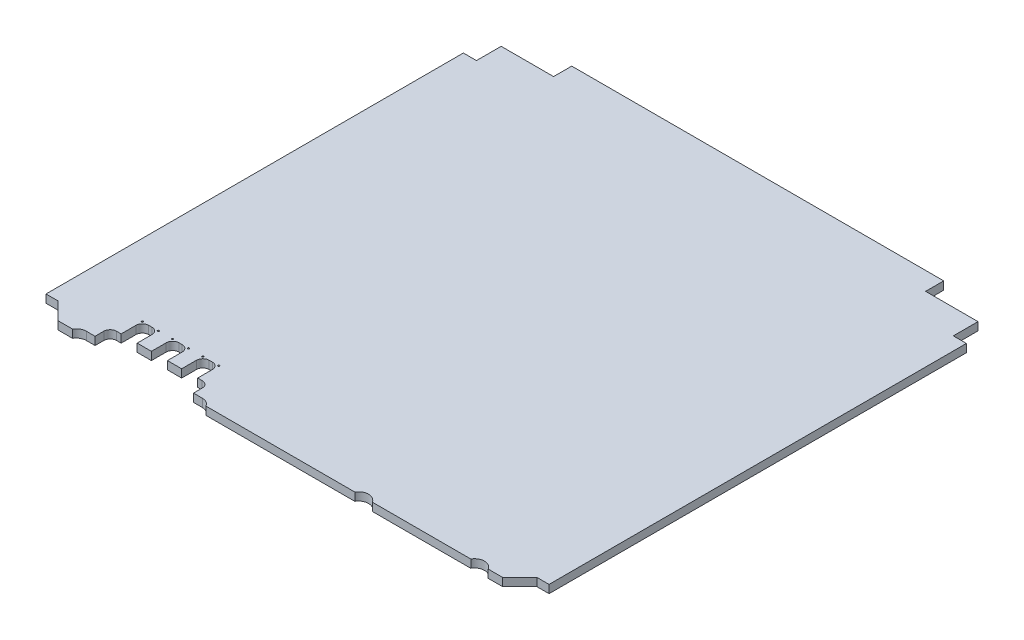
from build123d import *

# Parameters (mm, degrees)
GENERALSHAPE_DEPTH           = 0.8
ADDTOLERANCE_DEPTH           = 71.715203457
ADDTOLERANCE_DEPTH_BACK      = 71.715203457
BACKPLANE_DEPTH              = 71.573791169
BACKPLANE_DEPTH_BACK         = 71.573791169
RF_W                         = 3.18
RF_H                         = 4.2
CUT_EXTRUDE1_DEPTH           = 71.587392642
FILLET1_R                    = 1.27
F_0_32_0_32_DIAMETER_HOLE1_D = 0.32


with BuildPart() as part:
    # Sketch2 → GeneralShape (new, symmetric)
    with BuildSketch(Plane(origin=(0, 0, 0), x_dir=(1, 0, 0), z_dir=(0, 1, 0))):
        Polygon((47.4, 46.4), (37, 46.4), (37, 50), (-37, 50), (-37, 46.4), (-47.4, 46.4), (-47.4, 41.5), (-50, 41.5), (-50, -41.5), (-47.4, -41.5), (-41.5, -47.4), (41.5, -47.4), (47.4, -41.5), (50, -41.5), (50, 41.5), (47.4, 41.5), align=None)
    extrude(amount=GENERALSHAPE_DEPTH, both=True)

    # Sketch3 → AddTolerance (cut, two sides: drawn at the far end of the back side and taken through both)
    with BuildSketch(Plane(origin=(0, 0, 0), x_dir=(1, 0, 0), z_dir=(0, 1, 0)).offset(-ADDTOLERANCE_DEPTH_BACK)):
        Polygon((37, 50), (-37, 50), (-37, 46.4), (-47.4, 46.4), (-47.4, 41.5), (-50, 41.5), (-50, -41.5), (-47.4, -41.5), (-47.5, -41.4), (-49.9, -41.4), (-49.9, 41.4), (-47.3, 41.4), (-47.3, 46.3), (-36.9, 46.3), (-36.9, 49.9), (36.9, 49.9), (36.9, 46.3), (47.3, 46.3), (47.3, 41.4), (49.9, 41.4), (49.9, -41.4), (47.5, -41.4), (47.4, -41.5), (50, -41.5), (50, 41.5), (47.4, 41.5), (47.4, 46.4), (37, 46.4), align=None)
    extrude(amount=ADDTOLERANCE_DEPTH + ADDTOLERANCE_DEPTH_BACK, mode=Mode.SUBTRACT)

    # Sketch4 → Backplane (cut, two sides: drawn at the far end of the back side and taken through both)
    with BuildSketch(Plane(origin=(0, 0, 0), x_dir=(1, 0, 0), z_dir=(0, 1, 0)).offset(-BACKPLANE_DEPTH_BACK)):
        with BuildLine():
            Line((41.5, -47.4), (44.1, -44.8))
            Line((44.1, -44.8), (41.232050808, -44.8))
            ThreePointArc((41.232050808, -44.8), (39.5, -43.8), (37.767949192, -44.8))
            Line((37.767949192, -44.8), (18.232050808, -44.8))
            ThreePointArc((18.232050808, -44.8), (16.5, -43.8), (14.767949192, -44.8))
            Line((14.767949192, -44.8), (-14.767949192, -44.8))
            ThreePointArc((-14.767949192, -44.8), (-16.5, -43.8), (-18.232050808, -44.8))
            Line((-18.232050808, -44.8), (-37.767949192, -44.8))
            ThreePointArc((-37.767949192, -44.8), (-39.5, -43.8), (-41.232050808, -44.8))
            Line((-41.232050808, -44.8), (-44.1, -44.8))
            Line((-44.1, -44.8), (-41.5, -47.4))
            Line((-41.5, -47.4), (41.5, -47.4))
        make_face()
    extrude(amount=BACKPLANE_DEPTH + BACKPLANE_DEPTH_BACK, mode=Mode.SUBTRACT)

    # RF → Cut-Extrude1 (cut, through all)
    with BuildSketch(Plane(origin=(0, 0.8, 0), x_dir=(1, 0, 0), z_dir=(0, 1, 0))):
        with Locations((-22, -38.7)):
            Rectangle(RF_W, RF_H)
        with Locations((-28, -38.7)):
            Rectangle(RF_W, RF_H)
        with Locations((-34, -38.7)):
            Rectangle(RF_W, RF_H)
        with BuildLine():
            Line((-18.232050808, -40.8), (-20.41, -40.8))
            Line((-20.41, -40.8), (-23.59, -40.8))
            Line((-23.59, -40.8), (-26.41, -40.8))
            Line((-26.41, -40.8), (-29.59, -40.8))
            Line((-29.59, -40.8), (-32.41, -40.8))
            Line((-32.41, -40.8), (-35.59, -40.8))
            Line((-35.59, -40.8), (-37.767949192, -40.8))
            Line((-37.767949192, -40.8), (-37.767949192, -43.8))
            Line((-37.767949192, -43.8), (-39.5, -43.8))
            ThreePointArc((-39.5, -43.8), (-38.5, -44.067949192), (-37.767949192, -44.8))
            Line((-37.767949192, -44.8), (-18.232050808, -44.8))
            ThreePointArc((-18.232050808, -44.8), (-17.5, -44.067949192), (-16.5, -43.8))
            Line((-16.5, -43.8), (-18.232050808, -43.8))
            Line((-18.232050808, -43.8), (-18.232050808, -40.8))
        make_face()
    extrude(amount=-CUT_EXTRUDE1_DEPTH, mode=Mode.SUBTRACT)

    # Fillet1
    fillet1_edges = [part.edges().sort_by_distance(p)[0] for p in [
        (-23.59, 0, 36.6),
        (-20.41, 0, 36.6),
        (-18.232050808, 0, 40.8),
        (-37.767949192, 0, 40.8),
        (-35.59, 0, 36.6),
        (-32.41, 0, 36.6),
        (-29.59, 0, 36.6),
        (-26.41, 0, 36.6),
    ]]
    fillet(fillet1_edges, radius=FILLET1_R)

    # Ø0.32 (0.32) Diameter Hole1 (through all)
    with Locations(Plane(origin=(0, 0.8, 0), x_dir=(1, 0, 0), z_dir=(0, 1, 0))):
        with Locations((-20.41, -36.6), (-23.59, -36.6), (-26.41, -36.6), (-29.59, -36.6), (-32.41, -36.6), (-35.59, -36.6)):
            Hole(F_0_32_0_32_DIAMETER_HOLE1_D / 2)


solid = part.part
